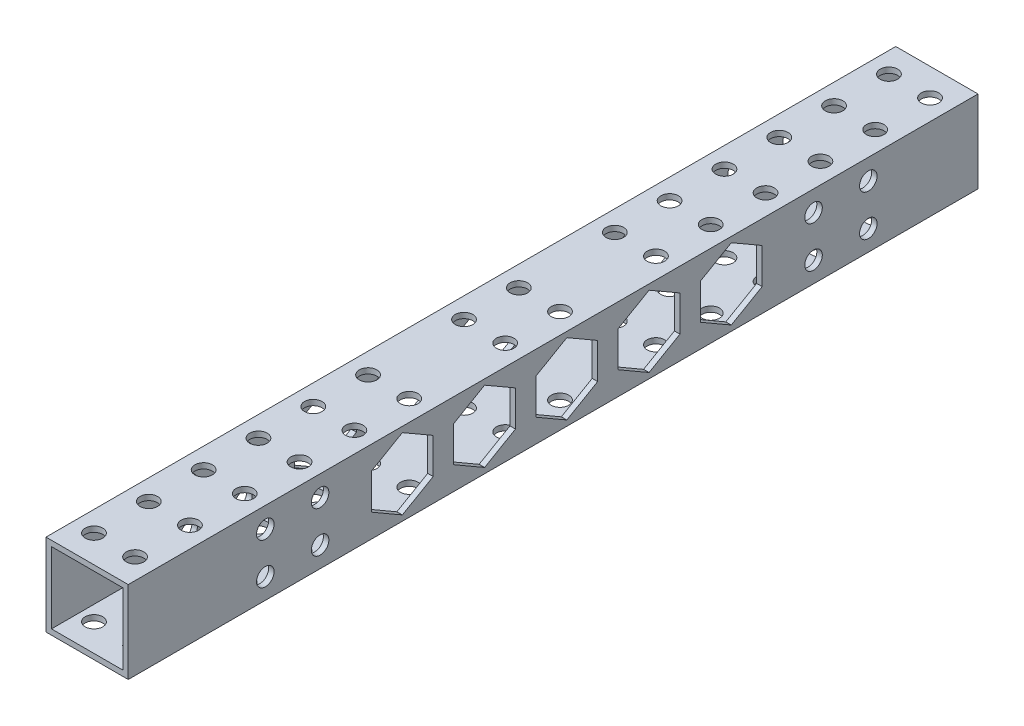
from build123d import *

# Parameters (mm, degrees)
SKETCH_1_W          = 15
SKETCH_1_H          = 15
SKETCH_1_W_2        = 13
SKETCH_1_H_2        = 13
EXTRUDE_1_DEPTH     = 155
SKETCH_2_R          = 1.6
CUT_EXTRUDE_1_DEPTH = 157.444878472
SKETCH_3_R          = 1.6
CUT_EXTRUDE_2_DEPTH = 157.444878472


with BuildPart() as part:
    # 草图1 → 拉伸-薄壁1 (new body)
    with BuildSketch(Plane.XY):
        with Locations((7.5, -7.5)):
            Rectangle(SKETCH_1_W, SKETCH_1_H)
        with Locations((7.5, -7.5)):
            Rectangle(SKETCH_1_W_2, SKETCH_1_H_2, mode=Mode.SUBTRACT)
    extrude(amount=EXTRUDE_1_DEPTH)

    # 草图2 → 切除-拉伸1 (cut, through all)
    with BuildSketch(Plane(origin=(15, 0, 0), x_dir=(0, 0, -1), z_dir=(1, 0, 0))):
        with Locations((-130, -3.75)):
            Circle(SKETCH_2_R)
        with Locations((-130, -11.25)):
            Circle(SKETCH_2_R)
        with Locations((-120, -11.25)):
            Circle(SKETCH_2_R)
        with Locations((-120, -3.75)):
            Circle(SKETCH_2_R)
        with Locations((-20, -3.75)):
            Circle(SKETCH_2_R)
        with Locations((-20, -11.25)):
            Circle(SKETCH_2_R)
        with Locations((-30, -11.25)):
            Circle(SKETCH_2_R)
        with Locations((-30, -3.75)):
            Circle(SKETCH_2_R)
        Polygon((-105, -1), (-110.629165125, -4.25), (-110.629165125, -10.75), (-105, -14), (-99.370834875, -10.75), (-99.370834875, -4.25), align=None)
        Polygon((-84.370834875, -10.75), (-84.370834875, -4.25), (-90, -1), (-95.629165125, -4.25), (-95.629165125, -10.75), (-90, -14), align=None)
        Polygon((-69.370834875, -10.75), (-69.370834875, -4.25), (-75, -1), (-80.629165125, -4.25), (-80.629165125, -10.75), (-75, -14), align=None)
        Polygon((-54.370834875, -10.75), (-54.370834875, -4.25), (-60, -1), (-65.629165125, -4.25), (-65.629165125, -10.75), (-60, -14), align=None)
        Polygon((-39.370834875, -10.75), (-39.370834875, -4.25), (-45, -1), (-50.629165125, -4.25), (-50.629165125, -10.75), (-45, -14), align=None)
    extrude(amount=-CUT_EXTRUDE_1_DEPTH, mode=Mode.SUBTRACT)

    # 草图3 → 切除-拉伸2 (cut, through all)
    with BuildSketch(Plane(origin=(0, 0, 0), x_dir=(1, 0, 0), z_dir=(0, 1, 0))):
        with Locations(Location((3.75, -5, 0), (0, 0, 270))):
            Circle(SKETCH_3_R)
        with Locations(Location((11.25, -5, 0), (0, 0, 90))):
            Circle(SKETCH_3_R)
        with Locations(Location((11.25, -15, 0), (0, 0, 270))):
            Circle(SKETCH_3_R)
        with Locations(Location((3.75, -15, 0), (0, 0, 90))):
            Circle(SKETCH_3_R)
        with Locations(Location((3.75, -25, 0), (0, 0, 270))):
            Circle(SKETCH_3_R)
        with Locations(Location((11.25, -25, 0), (0, 0, 90))):
            Circle(SKETCH_3_R)
        with Locations(Location((11.25, -35, 0), (0, 0, 270))):
            Circle(SKETCH_3_R)
        with Locations(Location((3.75, -35, 0), (0, 0, 90))):
            Circle(SKETCH_3_R)
        with Locations(Location((3.75, -45, 0), (0, 0, 270))):
            Circle(SKETCH_3_R)
        with Locations(Location((11.25, -45, 0), (0, 0, 90))):
            Circle(SKETCH_3_R)
        with Locations(Location((11.25, -55, 0), (0, 0, 270))):
            Circle(SKETCH_3_R)
        with Locations(Location((3.75, -55, 0), (0, 0, 90))):
            Circle(SKETCH_3_R)
        with Locations(Location((3.75, -72.5, 0), (0, 0, 270))):
            Circle(SKETCH_3_R)
        with Locations(Location((11.25, -72.5, 0), (0, 0, 90))):
            Circle(SKETCH_3_R)
        with Locations(Location((11.25, -82.5, 0), (0, 0, 270))):
            Circle(SKETCH_3_R)
        with Locations(Location((3.75, -82.5, 0), (0, 0, 90))):
            Circle(SKETCH_3_R)
        with Locations(Location((3.75, -100, 0), (0, 0, 270))):
            Circle(SKETCH_3_R)
        with Locations(Location((11.25, -100, 0), (0, 0, 90))):
            Circle(SKETCH_3_R)
        with Locations(Location((11.25, -110, 0), (0, 0, 270))):
            Circle(SKETCH_3_R)
        with Locations(Location((3.75, -110, 0), (0, 0, 90))):
            Circle(SKETCH_3_R)
        with Locations(Location((3.75, -120, 0), (0, 0, 270))):
            Circle(SKETCH_3_R)
        with Locations(Location((11.25, -120, 0), (0, 0, 90))):
            Circle(SKETCH_3_R)
        with Locations(Location((11.25, -130, 0), (0, 0, 270))):
            Circle(SKETCH_3_R)
        with Locations(Location((3.75, -130, 0), (0, 0, 90))):
            Circle(SKETCH_3_R)
        with Locations(Location((3.75, -140, 0), (0, 0, 270))):
            Circle(SKETCH_3_R)
        with Locations(Location((11.25, -140, 0), (0, 0, 90))):
            Circle(SKETCH_3_R)
        with Locations(Location((11.25, -150, 0), (0, 0, 270))):
            Circle(SKETCH_3_R)
        with Locations(Location((3.75, -150, 0), (0, 0, 90))):
            Circle(SKETCH_3_R)
    extrude(amount=-CUT_EXTRUDE_2_DEPTH, mode=Mode.SUBTRACT)


solid = part.part
